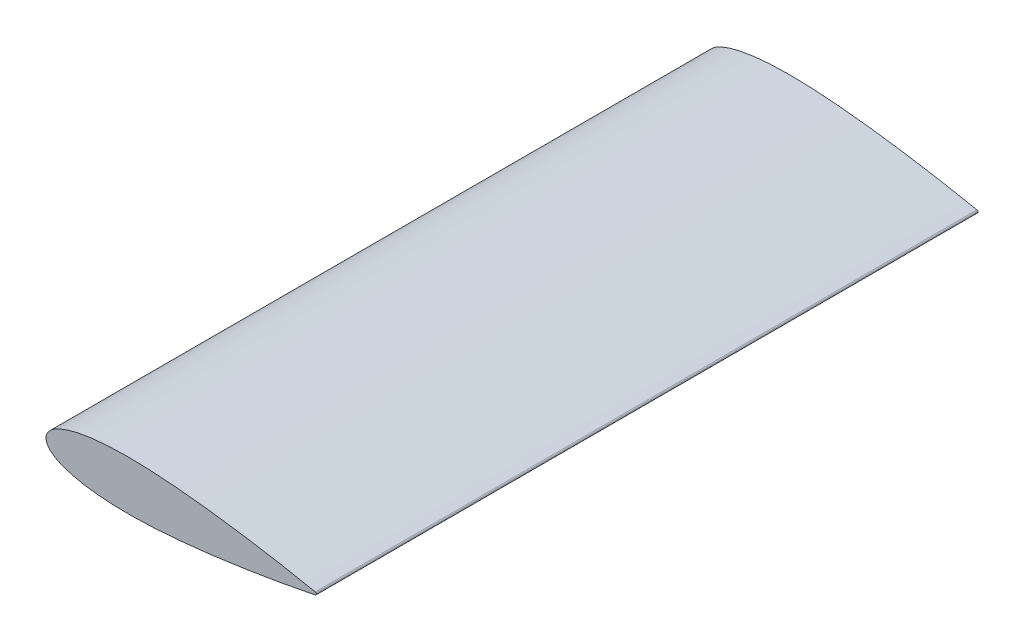
from build123d import *

# Parameters (mm, degrees)
BOSS_EXTRUDE1_DEPTH = 1200


with BuildPart() as part:
    # Sketch2 → Boss-Extrude1 (new body)
    with BuildSketch(Plane.XY):
        with BuildLine():
            ThreePointArc((488.305144841, -2.448390252), (490.299788361, 3.5e-08), (488.305144772, 2.448390267))
            add(Edge.make_bspline(
                [(488.305144772, 2.448390267), (488.124811309, 2.485611748), (487.387854717, 2.637623072), (486.05971682, 2.910850562), (484.286396793, 3.27416329), (482.410310751, 3.656850243), (480.432284688, 4.058487907), (478.353183223, 4.478614651), (476.173916668, 4.916763697), (473.895444753, 5.372457134), (471.518763052, 5.845184548), (469.044916792, 6.334445454), (466.474991312, 6.839720042), (463.810112154, 7.360467708), (461.051447255, 7.896136083), (458.200211186, 8.446204155), (455.257648866, 9.010071656), (452.225056209, 9.587208077), (449.103759993, 10.17701628), (445.895128907, 10.77892519), (442.600572158, 11.392345654), (439.221533967, 12.016692478), (435.759495547, 12.651362456), (432.215978932, 13.295777522), (428.592536015, 13.949319099), (424.890755113, 14.611381893), (421.112262139, 15.2813738), (417.258712116, 15.95866948), (413.331799058, 16.642676873), (409.333242325, 17.332758314), (405.264797071, 18.028305842), (401.12824943, 18.728706342), (396.925409156, 19.433325318), (392.658121539, 20.141537756), (388.328261773, 20.852725088), (383.937726638, 21.566243161), (379.488442364, 22.281449277), (374.98236013, 22.997709257), (370.421458195, 23.714376272), (365.80773461, 24.430795504), (361.143213717, 25.146304516), (356.429942258, 25.860250033), (351.669987148, 26.571951528), (346.865436386, 27.280728548), (342.018398966, 27.985910889), (337.130997682, 28.686782235), (332.205380076, 29.382670736), (327.243704839, 30.072849518), (322.248148097, 30.756608787), (317.220899218, 31.433221282), (312.164167374, 32.101960715), (307.080168058, 32.762079089), (301.971131717, 33.412832222), (296.839297221, 34.053468915), (291.68691645, 34.683213591), (286.51625164, 35.301300175), (281.329569222, 35.906952918), (276.129144691, 36.499394354), (270.917256628, 37.077825141), (265.696193996, 37.64145893), (260.468244936, 38.189500864), (255.235702232, 38.721149197), (250.000860929, 39.235606314), (244.766017084, 39.732069646), (239.533467861, 40.209748519), (234.305507255, 40.667839618), (229.084428367, 41.105552195), (223.872520254, 41.522113386), (218.672069544, 41.916728174), (213.485357137, 42.28864146), (208.314656837, 42.637085196), (203.162235703, 42.961325246), (198.030354881, 43.260629947), (192.921267334, 43.534284266), (187.837211005, 43.781591837), (182.780415971, 44.001887347), (177.753098047, 44.194508437), (172.757465889, 44.358844554), (167.795708691, 44.494282396), (162.870001456, 44.600259134), (157.982505285, 44.676221014), (153.13536353, 44.721678415), (148.330702306, 44.736146881), (143.570628116, 44.719175944), (138.857228797, 44.67038427), (134.192572712, 44.589379998), (129.578704085, 44.475864589), (125.017647985, 44.329535933), (120.511401945, 44.150163292), (116.061944501, 43.93753369), (111.671224651, 43.691504021), (107.341168757, 43.41195754), (103.073675285, 43.098820421), (98.87061569, 42.752086648), (94.733835659, 42.371763111), (90.665145817, 41.957922905), (86.666329263, 41.510687142), (82.739140957, 41.03019369), (78.885299923, 40.516668311), (75.106498014, 39.970333466), (71.404390379, 39.391487483), (67.780599016, 38.780453931), (64.236711638, 38.137591175), (60.774280149, 37.46330837), (57.394821588, 36.758041779), (54.09981554, 36.022271496), (50.890702522, 35.256500741), (47.76888995, 34.461260485), (44.735742368, 33.637109836), (41.792580543, 32.784658859), (38.940696102, 31.904489357), (36.181331285, 30.99724863), (33.515690871, 30.063577507), (30.944934289, 29.104146131), (28.470183732, 28.119616072), (26.092514114, 27.110669759), (23.812954657, 26.077998009), (21.632502006, 25.02226675), (19.552091496, 23.944180858), (17.572625969, 22.844403434), (15.694964212, 21.723594222), (13.919899036, 20.582431565), (12.24821673, 19.421521136), (10.680625445, 18.24149888), (9.217812421, 17.042941354), (7.860407943, 15.826423741), (6.609019222, 14.592471751), (5.464212262, 13.34159089), (4.426514711, 12.074256786), (3.496455219, 10.790897127), (2.67449404, 9.491945249), (1.961116711, 8.177788254), (1.356728499, 6.848830926), (0.861749549, 5.505455921), (0.476518811, 4.148063857), (0.201298831, 2.777062155), (0.03632042, 1.392834471), (-0.018187176, 0), (0.03632042, -1.392834471), (0.201298831, -2.777062155), (0.476518811, -4.148063857), (0.861749549, -5.505455921), (1.356728499, -6.848830926), (1.961116711, -8.177788254), (2.67449404, -9.491945249), (3.496455219, -10.790897127), (4.426514711, -12.074256786), (5.464212262, -13.34159089), (6.609019222, -14.592471751), (7.860407943, -15.826423741), (9.217812421, -17.042941354), (10.680625444, -18.24149888), (12.24821673, -19.421521135), (13.919899032, -20.582431573), (15.694964227, -21.723594192), (17.572625913, -22.844403551), (19.552091716, -23.944180398), (21.632500497, -25.02226822), (23.812957347, -26.077990609), (26.092512559, -27.110671493), (28.470183991, -28.11961551), (30.944934217, -29.104146288), (33.515690891, -30.063577463), (36.181331279, -30.997248643), (38.940696104, -31.904489353), (41.792580542, -32.78465886), (44.735742368, -33.637109836), (47.76888995, -34.461260485), (50.890702522, -35.256500741), (54.09981554, -36.022271496), (57.394821588, -36.758041779), (60.774280149, -37.46330837), (64.236711638, -38.137591175), (67.780599016, -38.780453931), (71.404390379, -39.391487483), (75.106498014, -39.970333466), (78.885299923, -40.516668311), (82.739140957, -41.03019369), (86.666329263, -41.510687142), (90.665145817, -41.957922905), (94.733835659, -42.371763111), (98.87061569, -42.752086648), (103.073675285, -43.098820421), (107.341168757, -43.41195754), (111.671224651, -43.691504021), (116.061944501, -43.93753369), (120.511401945, -44.150163292), (125.017647985, -44.329535933), (129.578704085, -44.475864589), (134.192572712, -44.589379998), (138.857228797, -44.67038427), (143.570628116, -44.719175944), (148.330702306, -44.736146881), (153.13536353, -44.721678415), (157.982505285, -44.676221014), (162.870001456, -44.600259134), (167.795708691, -44.494282396), (172.757465889, -44.358844554), (177.753098047, -44.194508437), (182.780415971, -44.001887347), (187.837211005, -43.781591837), (192.921267334, -43.534284266), (198.030354881, -43.260629947), (203.162235703, -42.961325246), (208.314656837, -42.637085196), (213.485357137, -42.28864146), (218.672069544, -41.916728174), (223.872520254, -41.522113386), (229.084428367, -41.105552195), (234.305507255, -40.667839618), (239.533467861, -40.209748519), (244.766017084, -39.732069646), (250.000860929, -39.235606314), (255.235702232, -38.721149197), (260.468244936, -38.189500864), (265.696193996, -37.64145893), (270.917256628, -37.077825141), (276.129144691, -36.499394354), (281.329569222, -35.906952918), (286.51625164, -35.301300175), (291.68691645, -34.683213591), (296.839297221, -34.053468915), (301.971131717, -33.412832222), (307.080168058, -32.762079089), (312.164167374, -32.101960715), (317.220899218, -31.433221282), (322.248148097, -30.756608787), (327.243704839, -30.072849518), (332.205380076, -29.382670736), (337.130997682, -28.686782235), (342.018398966, -27.985910889), (346.865436386, -27.280728548), (351.669987148, -26.571951528), (356.429942258, -25.860250033), (361.143213717, -25.146304516), (365.80773461, -24.430795504), (370.421458195, -23.714376272), (374.98236013, -22.997709257), (379.488442364, -22.281449277), (383.937726638, -21.566243161), (388.328261773, -20.852725088), (392.658121539, -20.141537756), (396.925409156, -19.433325318), (401.12824943, -18.728706342), (405.264797071, -18.028305842), (409.333242325, -17.332758314), (413.331799058, -16.642676873), (417.258712116, -15.95866948), (421.112262139, -15.2813738), (424.890755113, -14.611381893), (428.592536015, -13.949319099), (432.215978932, -13.295777522), (435.759495547, -12.651362456), (439.221533967, -12.016692478), (442.600572158, -11.392345654), (445.895128907, -10.77892519), (449.103759993, -10.17701628), (452.225056209, -9.587208077), (455.257648866, -9.010071656), (458.200211186, -8.446204155), (461.051447255, -7.896136083), (463.810112154, -7.360467708), (466.474991312, -6.839720042), (469.044916792, -6.334445454), (471.518763052, -5.845184548), (473.895444753, -5.372457134), (476.173916668, -4.916763697), (478.353183223, -4.478614651), (480.432284688, -4.058487907), (482.410310751, -3.656850243), (484.286396793, -3.27416329), (486.05971682, -2.910850562), (487.387854739, -2.637623067), (488.124811355, -2.485611739), (488.305144841, -2.448390252)],
                knots=[0.011510755, 0.011510755, 0.011510755, 0.011510755, 0.012042925, 0.01368548, 0.015429605, 0.017274475, 0.019219232, 0.02126298, 0.023404762, 0.025643592, 0.027978427, 0.030408194, 0.032931771, 0.035547993, 0.038255663, 0.041053536, 0.043940333, 0.046914729, 0.049975374, 0.053120869, 0.056349784, 0.05966065, 0.06305197, 0.066522203, 0.070069779, 0.073693097, 0.077390524, 0.081160389, 0.085000998, 0.088910622, 0.092887501, 0.096929853, 0.101035865, 0.1052037, 0.109431482, 0.11371732, 0.118059304, 0.122455481, 0.126903894, 0.131402554, 0.135949452, 0.140542555, 0.14517982, 0.149859171, 0.15457852, 0.159335772, 0.164128799, 0.168955466, 0.173813628, 0.178701121, 0.18361577, 0.188555384, 0.193517776, 0.198500741, 0.203502067, 0.208519532, 0.213550913, 0.218593994, 0.223646538, 0.228706316, 0.233771101, 0.238838666, 0.243906784, 0.248973236, 0.254035809, 0.259092291, 0.264140488, 0.269178212, 0.274203287, 0.279213541, 0.284206836, 0.289181037, 0.294134023, 0.299063698, 0.303967983, 0.30884483, 0.313692201, 0.318508089, 0.323290505, 0.328037501, 0.332747149, 0.337417538, 0.34204681, 0.346633125, 0.351174672, 0.355669685, 0.360116424, 0.364513186, 0.368858306, 0.373150162, 0.377387152, 0.381567737, 0.385690407, 0.389753683, 0.393756144, 0.397696405, 0.401573133, 0.405385029, 0.409130846, 0.41280939, 0.416419508, 0.419960102, 0.423430134, 0.426828616, 0.430154611, 0.43340726, 0.436585753, 0.439689359, 0.442717409, 0.445669327, 0.448544603, 0.451342832, 0.454063693, 0.45670698, 0.459272601, 0.46176059, 0.464171125, 0.466504538, 0.468761337, 0.470942219, 0.473048111, 0.475080176, 0.477039846, 0.478928872, 0.480749348, 0.482503758, 0.48419501, 0.485826495, 0.487402124, 0.488926373, 0.490404306, 0.491841607, 0.493244555, 0.494620023, 0.495975377, 0.497318415, 0.498657216, 0.5, 0.501342784, 0.502681585, 0.504024623, 0.505379977, 0.506755445, 0.508158393, 0.509595694, 0.511073628, 0.512597876, 0.514173505, 0.515804991, 0.517496242, 0.519250652, 0.521071128, 0.522960155, 0.524919825, 0.526951889, 0.529057781, 0.531238663, 0.533495462, 0.535828873, 0.53823941, 0.540727399, 0.54329302, 0.545936307, 0.548657168, 0.551455397, 0.554330673, 0.557282591, 0.560310641, 0.563414247, 0.56659274, 0.569845389, 0.573171384, 0.576569866, 0.580039898, 0.583580492, 0.58719061, 0.590869154, 0.594614971, 0.598426867, 0.602303595, 0.606243856, 0.610246317, 0.614309593, 0.618432263, 0.622612848, 0.626849838, 0.631141694, 0.635486814, 0.639883576, 0.644330315, 0.648825328, 0.653366875, 0.65795319, 0.662582462, 0.667252851, 0.671962499, 0.676709495, 0.681491911, 0.686307799, 0.69115517, 0.696032017, 0.700936302, 0.705865977, 0.710818963, 0.715793164, 0.720786459, 0.725796713, 0.730821788, 0.735859512, 0.740907709, 0.745964191, 0.751026764, 0.756093216, 0.761161334, 0.766228899, 0.771293684, 0.776353462, 0.781406006, 0.786449087, 0.791480468, 0.796497933, 0.801499259, 0.806482224, 0.811444616, 0.81638423, 0.821298879, 0.826186372, 0.831044534, 0.835871201, 0.840664228, 0.84542148, 0.850140829, 0.85482018, 0.859457445, 0.864050548, 0.868597446, 0.873096106, 0.877544519, 0.881940696, 0.88628268, 0.890568518, 0.8947963, 0.898964135, 0.903070147, 0.907112499, 0.911089378, 0.914999002, 0.918839611, 0.922609476, 0.926306903, 0.929930221, 0.933477797, 0.93694803, 0.94033935, 0.943650216, 0.946879131, 0.950024626, 0.953085271, 0.956059667, 0.958946464, 0.961744337, 0.964452007, 0.967068229, 0.969591806, 0.972021573, 0.974356408, 0.976595238, 0.97873702, 0.980780768, 0.982725525, 0.984570395, 0.98631452, 0.987957075, 0.988489245, 0.988489245, 0.988489245, 0.988489245], degree=3))
        make_face()
    extrude(amount=BOSS_EXTRUDE1_DEPTH)


solid = part.part
